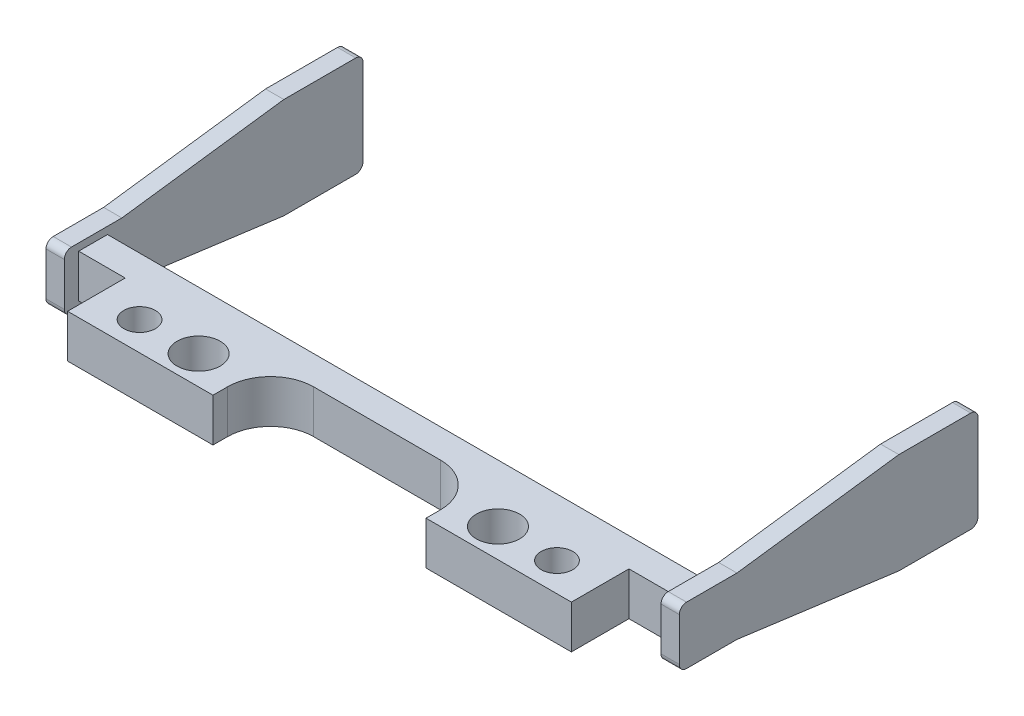
from build123d import *

# Parameters (mm, degrees)
SKETCH1_W           = 101
SKETCH1_H           = 40
SKETCH1_R           = 11
SKETCH1_R_2         = 10
BOSS_EXTRUDE1_DEPTH = 30
FILLET1_R           = 30
FILLET2_R           = 30
BOSS_EXTRUDE2_DEPTH = 12.7
LPATTERN2_COUNT     = 2
LPATTERN2_PITCH     = 427.3
CUT_EXTRUDE1_REACH  = 295.353
SKETCH3_R           = 15


with BuildPart() as part:
    # Sketch1 → Boss-Extrude1 (new body)
    # profile 1 of 3: a face of its own
    with BuildSketch(Plane(origin=(0, 0, 0), x_dir=(1, 0, 0), z_dir=(0, 1, 0))):
        with Locations((-124.5, -30)):
            Rectangle(SKETCH1_W, SKETCH1_H)
        with Locations(Location((-145, -30, 0), (0, 0, 270))):
            Circle(SKETCH1_R, mode=Mode.SUBTRACT)
        with Locations(Location((-104, -30, 0), (0, 0, 270))):
            Circle(SKETCH1_R_2, mode=Mode.SUBTRACT)
    # profile 2 of 3: a face of its own
    with BuildSketch(Plane(origin=(0, 0, 0), x_dir=(1, 0, 0), z_dir=(0, 1, 0))):
        Polygon((220, 10), (-220, 10), (-220, -10), (-217.730894996, -10), (-215.497523929, -10), (-204.607421626, -10), (-182.730894996, -10), (-175, -10), (-74, -10), (74, -10), (175, -10), (220, -10), align=None)
    # profile 3 of 3: a face of its own
    with BuildSketch(Plane(origin=(0, 0, 0), x_dir=(1, 0, 0), z_dir=(0, 1, 0))):
        with Locations((124.5, -30)):
            Rectangle(SKETCH1_W, SKETCH1_H)
        with Locations(Location((104, -30, 0), (0, 0, 270))):
            Circle(SKETCH1_R_2, mode=Mode.SUBTRACT)
        with Locations(Location((145, -30, 0), (0, 0, 270))):
            Circle(SKETCH1_R, mode=Mode.SUBTRACT)
    extrude(amount=BOSS_EXTRUDE1_DEPTH)

    # Fillet1
    fillet1_edges = [part.edges().sort_by_distance(p)[0] for p in [
        (-74, 15, 10),
    ]]
    fillet(fillet1_edges, radius=FILLET1_R)

    # Fillet2
    fillet2_edges = [part.edges().sort_by_distance(p)[0] for p in [
        (74, 15, 10),
    ]]
    fillet(fillet2_edges, radius=FILLET2_R)

    # Sketch2 → Boss-Extrude2 (add)
    with BuildSketch(Plane(origin=(220, 0, 0), x_dir=(0, 0, -1), z_dir=(1, 0, 0))):
        with BuildLine():
            Line((20.00915922, 34.992960702), (-15.016204221, 34.992960702))
            ThreePointArc((-15.016204221, 34.992960702), (-18.550303731, 33.529088755), (-20.014175678, 29.994989245))
            Line((-20.014175678, 29.994989245), (-20.014175678, -1.642e-06))
            ThreePointArc((-20.014175678, -1.642e-06), (-18.550303731, -3.534101152), (-15.016204221, -4.997973099))
            Line((-15.016204221, -4.997973099), (20.019193394, -4.997973099))
            Line((20.019193394, -4.997973099), (132.5, -20))
            Line((132.5, -20), (182.5, -20))
            ThreePointArc((182.5, -20), (186.035533906, -18.535533906), (187.5, -15))
            Line((187.5, -15), (187.5, 45))
            ThreePointArc((187.5, 45), (186.035533906, 48.535533906), (182.5, 50))
            Line((182.5, 50), (132.5, 50))
            Line((132.5, 50), (20.00915922, 34.992960702))
        make_face()
    boss_extrude2 = extrude(amount=-BOSS_EXTRUDE2_DEPTH)

    # LPattern2: Boss-Extrude2 ×2
    with Locations(*[(-i * LPATTERN2_PITCH, 0, 0) for i in range(1, LPATTERN2_COUNT)]):
        add(boss_extrude2)

    # Sketch3 → Cut-Extrude1 (cut, up to next)
    with BuildSketch(Plane(origin=(0, 30, 0), x_dir=(1, 0, 0), z_dir=(0, 1, 0)), mode=Mode.PRIVATE) as cut_extrude1_sk1:
        with Locations(Location((-104, -30, 0), (0, 0, 270))):
            Circle(SKETCH3_R)
    cut_extrude1_tool1 = extrude(cut_extrude1_sk1.sketch, amount=-CUT_EXTRUDE1_REACH, mode=Mode.PRIVATE) & part.part
    # Sketch3 → Cut-Extrude1 (cut, up to next)
    with BuildSketch(Plane(origin=(0, 30, 0), x_dir=(1, 0, 0), z_dir=(0, 1, 0)), mode=Mode.PRIVATE) as cut_extrude1_sk2:
        with Locations(Location((104, -30, 0), (0, 0, 270))):
            Circle(SKETCH3_R)
    cut_extrude1_tool2 = extrude(cut_extrude1_sk2.sketch, amount=-CUT_EXTRUDE1_REACH, mode=Mode.PRIVATE) & part.part
    add(cut_extrude1_tool1.solids().sort_by_distance((-104, 30, 30))[0], mode=Mode.SUBTRACT)
    add(cut_extrude1_tool2.solids().sort_by_distance((104, 30, 30))[0], mode=Mode.SUBTRACT)


solid = part.part
